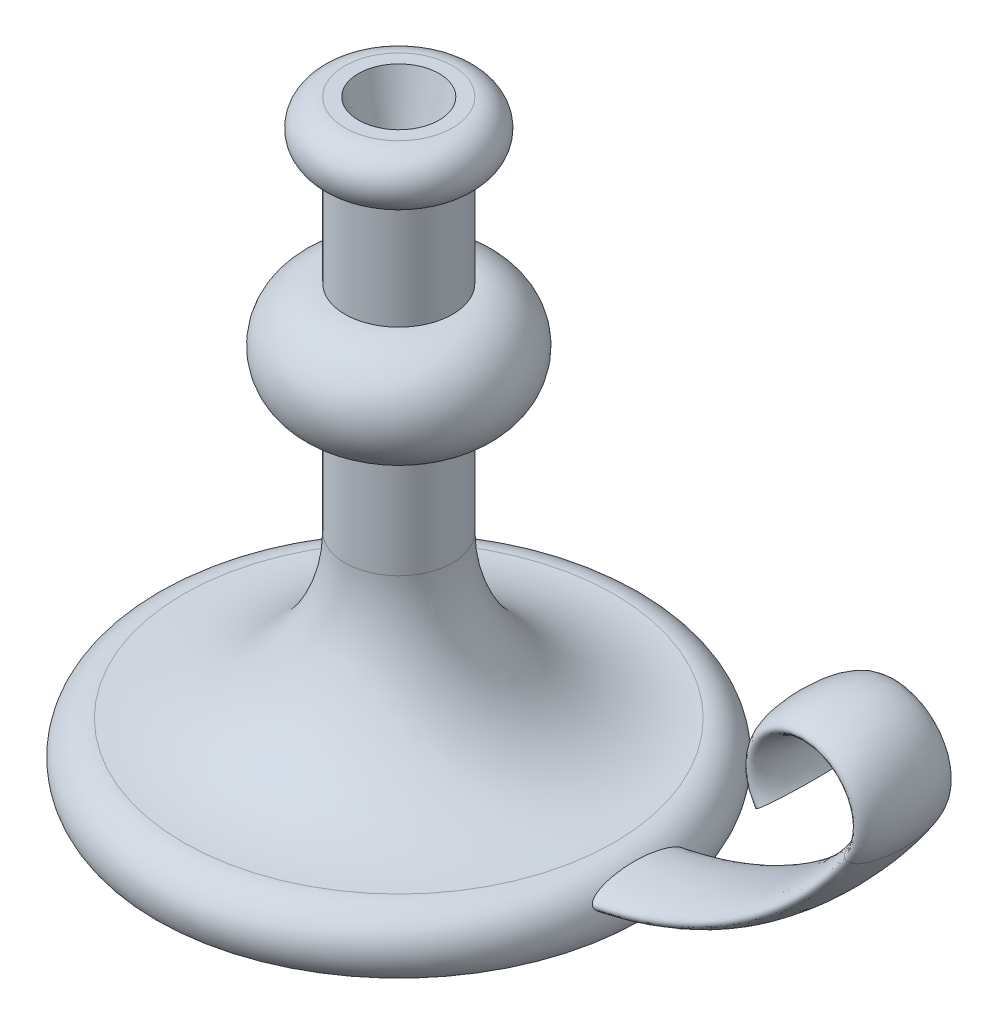
from build123d import *

# Parameters (mm, degrees)
SKETCH_4_RX         = 17.5
SKETCH_4_RY         = 5
SKETCH_6_R          = 15
CUT_EXTRUDE_1_DEPTH = 25
CUT_EXTRUDE_1_DRAFT = -15


with BuildPart() as part:
    # 草图1 → 旋转3 (revolve)
    with BuildSketch(Plane.XY, mode=Mode.PRIVATE) as revolve_3_sk:
        with BuildLine():
            ThreePointArc((80, 20), (91.180339887, 13.090169944), (90, 0))
            Line((90, 0), (0, 0))
            Line((0, 0), (0, 220))
            Line((0, 220), (20, 220))
            ThreePointArc((20, 220), (30, 210), (20, 200))
            Line((20, 200), (20, 160))
            ThreePointArc((20, 160), (40, 140), (20, 120))
            Line((20, 120), (20, 80))
            ThreePointArc((20, 80), (37.573593129, 37.573593129), (80, 20))
        make_face()
    revolve(revolve_3_sk.sketch.rotate(Axis((0, 220, 0), (0, -1, 0)), 180), axis=Axis((0, 220, 0), (0, -1, 0)))

    # 扫描1: sweep along a path in 草图2
    with BuildLine(Plane.XY) as sweep_1_path:
        Line((0, 10), (60, 10))
        ThreePointArc((60, 10), (129.821200219, 27.240819526), (183.592070943, 75))
        ThreePointArc((183.592070943, 75), (167.113128151, 106.333333333), (150.634185358, 75))
    # 草图4 → 扫描1 (sweep)
    with BuildSketch(Plane(origin=(0, 0, 0), x_dir=(0, 0, -1), z_dir=(1, 0, 0))):
        with Locations((0, 10)):
            Ellipse(SKETCH_4_RX, SKETCH_4_RY)
    sweep(path=sweep_1_path.line)


with BuildPart() as cut_extrude_1_tool:
    # 草图6 → 切除-拉伸1 (with draft: the straight prism first)
    with BuildSketch(Plane(origin=(0, 220, 0), x_dir=(1, 0, 0), z_dir=(0, 1, 0))):
        Circle(SKETCH_6_R)
    extrude(amount=-CUT_EXTRUDE_1_DEPTH)
    # 切除-拉伸1: the draft: its side faces are tilted about the plane it starts from
    cut_extrude_1_sides = [cut_extrude_1_tool.faces().sort_by_distance(p)[0] for p in [
        (-15, 207.5, 0),
    ]]
    draft(cut_extrude_1_sides, Plane(origin=(0, 220, 0), x_dir=(1, 0, 0), z_dir=(0, 1, 0)), CUT_EXTRUDE_1_DRAFT)


with BuildPart() as part_1:
    add(part.part)

    # 切除-拉伸1: cut by cut_extrude_1_tool
    add(cut_extrude_1_tool.part, mode=Mode.SUBTRACT)


solid = part_1.part
